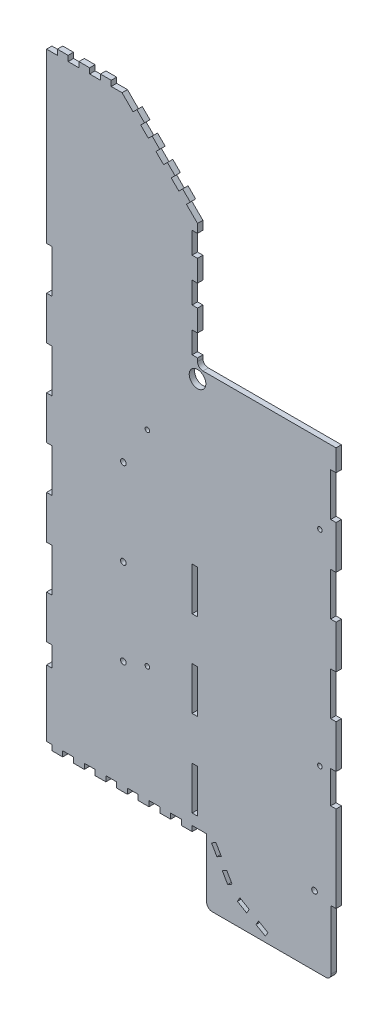
from build123d import *

# Parameters (mm, degrees)
SKETCH1_R           = 4.8895
SKETCH1_R_2         = 1.3335
SKETCH1_R_3         = 1.651
SKETCH1_W           = 3.175
SKETCH1_H           = 25.4
BOSS_EXTRUDE2_DEPTH = 3.175
FILLET1_R           = 3.175


with BuildPart() as part:
    # Sketch1 → Boss-Extrude2 (new body)
    with BuildSketch(Plane.XY):
        Polygon((0, 3.175), (3.175, 3.175), (3.175, 0), (9.525, 0), (9.525, 3.175), (15.875, 3.175), (15.875, 0), (22.225, 0), (22.225, 3.175), (28.575, 3.175), (28.575, 0), (34.925, 0), (34.925, 3.175), (41.275, 3.175), (41.275, 0), (47.625, 0), (47.625, 3.175), (53.975, 3.175), (53.975, 0), (60.325, 0), (60.325, 3.175), (66.675, 3.175), (66.675, 0), (73.025, 0), (73.025, 3.175), (79.375, 3.175), (79.375, 0), (85.725, 0), (85.725, 3.175), (88.9, 3.175), (94.2848, 3.175), (94.2848, -34.925), (167.535593046, -34.925), (167.535593046, 3.175), (170.4848, 3.175), (170.4848, 53.975), (167.3098, 53.975), (167.3098, 73.025), (170.4848, 73.025), (170.4848, 98.425), (167.3098, 98.425), (167.3098, 123.825), (170.4848, 123.825), (170.4848, 149.225), (167.3098, 149.225), (167.3098, 174.625), (170.4848, 174.625), (170.4848, 200.025), (167.3098, 200.025), (167.3098, 225.425), (170.4848, 225.425), (170.4848, 238.125), (88.9, 238.125), (88.9, 243.205), (85.725, 243.205), (85.725, 255.905), (88.9, 255.905), (88.9, 268.605), (85.725, 268.605), (85.725, 281.305), (88.9, 281.305), (88.9, 294.005), (85.725, 294.005), (85.725, 306.705), (88.9, 306.705), (88.9, 311.785), (82.390448212, 318.294551788), (84.635512242, 320.539615818), (80.145384182, 325.029743879), (77.900320151, 322.784679849), (73.410192091, 327.274807909), (75.655256121, 329.519871939), (71.165128061, 334.01), (68.92006403, 331.76493597), (64.42993597, 336.25506403), (66.675, 338.500128061), (62.184871939, 342.990256121), (59.939807909, 340.745192091), (55.449679849, 345.235320151), (57.694743879, 347.480384182), (53.204615818, 351.970512242), (50.959551788, 349.725448212), (44.45, 356.235), (38.1, 356.235), (38.1, 359.41), (31.75, 359.41), (31.75, 356.235), (25.4, 356.235), (25.4, 359.41), (19.05, 359.41), (19.05, 356.235), (12.7, 356.235), (12.7, 359.41), (6.35, 359.41), (6.35, 356.235), (0, 356.235), (0, 257.175), (3.175, 257.175), (3.175, 231.775), (0, 231.775), (0, 206.375), (3.175, 206.375), (3.175, 180.975), (0, 180.975), (0, 155.575), (3.175, 155.575), (3.175, 130.175), (0, 130.175), (0, 104.775), (3.175, 104.775), (3.175, 79.375), (0, 79.375), (0, 53.975), (3.175, 53.975), (3.175, 42.175), (0, 42.175), (0, 28.575), align=None)
        with Locations((88.9, 232.41)):
            Circle(SKETCH1_R, mode=Mode.SUBTRACT)
        with Locations((59.3598, 191.77)):
            Circle(SKETCH1_R_2, mode=Mode.SUBTRACT)
        with Locations((59.3598, 71.12)):
            Circle(SKETCH1_R_2, mode=Mode.SUBTRACT)
        with Locations((160.9598, 71.12)):
            Circle(SKETCH1_R_2, mode=Mode.SUBTRACT)
        with Locations((160.9598, 191.77)):
            Circle(SKETCH1_R_2, mode=Mode.SUBTRACT)
        with Locations((45.225, 66.574999946)):
            Circle(SKETCH1_R_3, mode=Mode.SUBTRACT)
        with Locations((45.225, 117.374999946)):
            Circle(SKETCH1_R_3, mode=Mode.SUBTRACT)
        with Locations((45.225, 168.174999946)):
            Circle(SKETCH1_R_3, mode=Mode.SUBTRACT)
        with Locations((157.7848, 5.969)):
            Circle(SKETCH1_R_3, mode=Mode.SUBTRACT)
        with Locations((87.3125, 123.825)):
            Rectangle(SKETCH1_W, SKETCH1_H, mode=Mode.SUBTRACT)
        Polygon((99.742302456, 1.4986), (102.917302456, -4.000661314), (100.321651116, -5.499261314), (97.146651116, 0), align=None, mode=Mode.SUBTRACT)
        with Locations((87.3125, 73.025)):
            Rectangle(SKETCH1_W, SKETCH1_H, mode=Mode.SUBTRACT)
        with Locations((87.3125, 22.225)):
            Rectangle(SKETCH1_W, SKETCH1_H, mode=Mode.SUBTRACT)
        Polygon((106.092302456, -9.499922628), (103.496651116, -10.998522628), (106.671651116, -16.497783942), (109.267302456, -14.999183942), align=None, mode=Mode.SUBTRACT)
        Polygon((113.854167186, -19.62934866), (112.355567186, -22.225), (117.8548285, -25.4), (119.3534285, -22.80434866), align=None, mode=Mode.SUBTRACT)
        Polygon((124.852689814, -25.97934866), (123.354089814, -28.575), (128.853351128, -31.75), (130.351951128, -29.15434866), align=None, mode=Mode.SUBTRACT)
    extrude(amount=BOSS_EXTRUDE2_DEPTH)

    # Fillet1
    fillet1_edges = [part.edges().sort_by_distance(p)[0] for p in [
        (88.9, 238.125, 1.5875),
        (167.535593046, -34.925, 1.5875),
        (94.2848, -34.925, 1.5875),
    ]]
    fillet(fillet1_edges, radius=FILLET1_R)


solid = part.part
